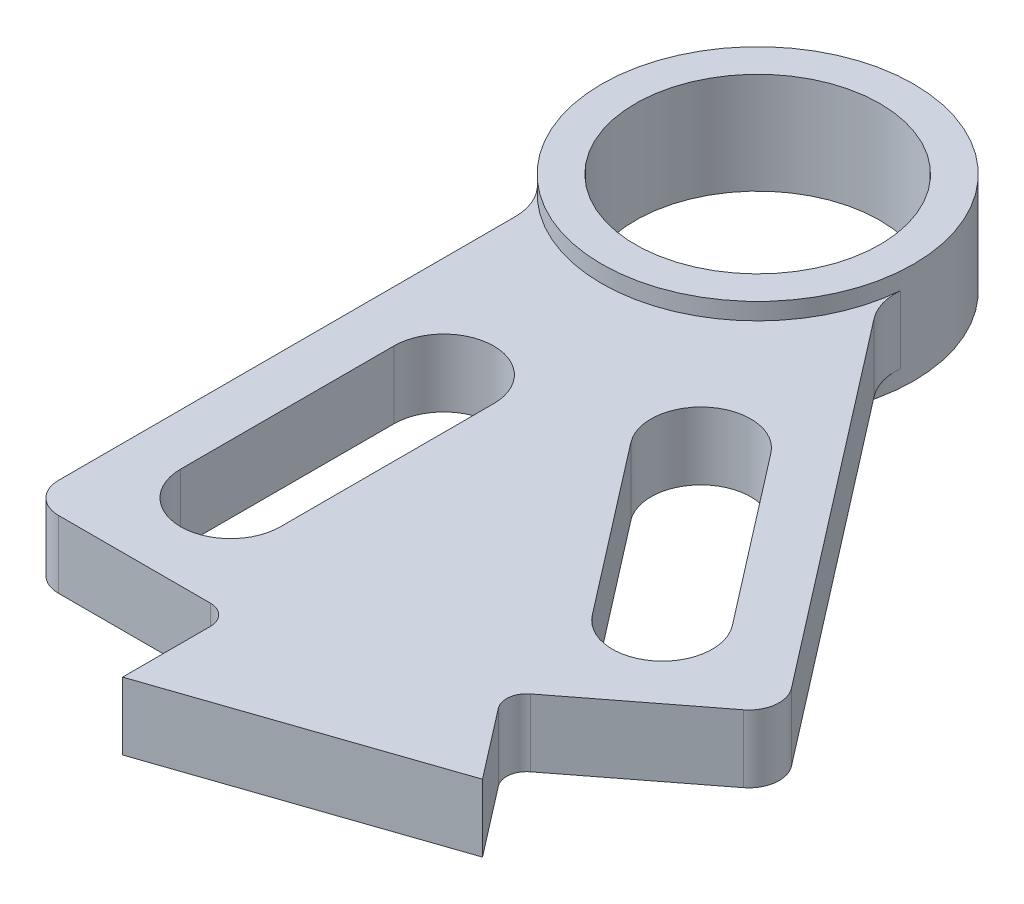
from build123d import *

# Parameters (mm, degrees)
SKETCH1_R             = 14.6812
SKETCH1_R_2           = 11.5062
BEARING_EXTRUDE_DEPTH = 4.7625
BOSS_EXTRUDE2_DEPTH   = 3.175
FILLET1_R             = 5.08
FILLET2_R             = 1.905
FILLET3_R             = 2.8575


with BuildPart() as part:
    # Sketch1 → Bearing extrude (new, symmetric)
    with BuildSketch(Plane(origin=(0, 0, 0), x_dir=(1, 0, 0), z_dir=(0, 1, 0))):
        with Locations(Location((0, 0, 0), (0, 0, 90))):
            Circle(SKETCH1_R)
        with Locations(Location((0, 0, 0), (0, 0, 90))):
            Circle(SKETCH1_R_2, mode=Mode.SUBTRACT)
    extrude(amount=BEARING_EXTRUDE_DEPTH, both=True)

    # Sketch1<5> → Boss-Extrude2 (add, symmetric)
    with BuildSketch(Plane(origin=(0, 0, 0), x_dir=(1, 0, 0), z_dir=(0, 1, 0))):
        with BuildLine():
            Line((-9.525, -11.171929486), (-9.525, -59.1312))
            Line((-9.525, -59.1312), (9.525, -59.1312))
            Line((9.525, -59.1312), (9.525, -69.2912))
            Line((9.525, -69.2912), (34.783484035, -60.68035317))
            Line((34.783484035, -60.68035317), (28.577468302, -52.636040352))
            Line((28.577468302, -52.636040352), (36.119011569, -46.817900602))
            Line((36.119011569, -46.817900602), (43.660554836, -40.999760851))
            Line((43.660554836, -40.999760851), (14.365674189, -3.027381467))
            ThreePointArc((14.365674189, -3.027381467), (4.737240469, -13.895905375), (-9.525, -11.171929486))
        make_face()
        with BuildLine():
            ThreePointArc((4.699, -49.6062), (0, -54.3052), (-4.699, -49.6062))
            Line((-4.699, -49.6062), (-4.699, -29.5402))
            ThreePointArc((-4.699, -29.5402), (0, -24.8412), (4.699, -29.5402))
            Line((4.699, -29.5402), (4.699, -49.6062))
        make_face(mode=Mode.SUBTRACT)
        with BuildLine():
            ThreePointArc((34.021366497, -36.406075058), (34.961254897, -39.877548289), (33.171154095, -42.996852013))
            ThreePointArc((33.171154095, -42.996852013), (29.699680864, -43.936740413), (26.58037714, -42.146639611))
            Line((26.58037714, -42.146639611), (14.323496067, -26.259121795))
            ThreePointArc((14.323496067, -26.259121795), (15.173708468, -19.66834484), (21.764485423, -20.518557242))
            Line((21.764485423, -20.518557242), (34.021366497, -36.406075058))
        make_face(mode=Mode.SUBTRACT)
    extrude(amount=BOSS_EXTRUDE2_DEPTH, both=True)

    # Fillet1
    fillet1_edges = [part.edges().sort_by_distance(p)[0] for p in [
        (14.365674189, 0, 3.027381467),
        (-9.525, 0, 11.171929486),
    ]]
    fillet(fillet1_edges, radius=FILLET1_R)

    # Fillet2
    fillet2_edges = [part.edges().sort_by_distance(p)[0] for p in [
        (28.577468302, 0, 52.636040352),
        (9.525, 0, 59.1312),
    ]]
    fillet(fillet2_edges, radius=FILLET2_R)

    # Fillet3
    fillet3_edges = [part.edges().sort_by_distance(p)[0] for p in [
        (43.660554836, 0, 40.999760851),
        (-9.525, 0, 59.1312),
    ]]
    fillet(fillet3_edges, radius=FILLET3_R)


solid = part.part
